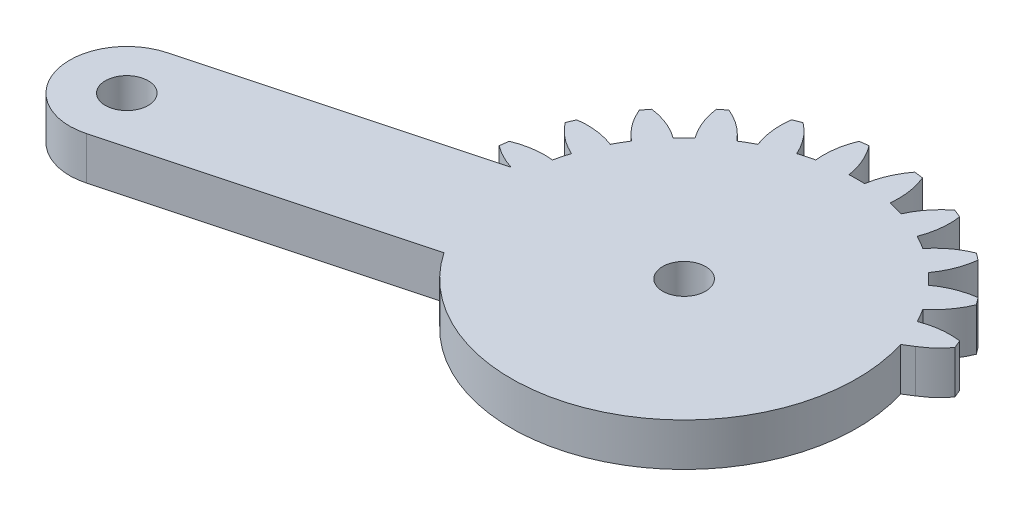
from build123d import *
from build123d.topology import SkipClean

# Parameters (mm, degrees)
SKETCH1_R           = 1.5
BOSS_EXTRUDE1_DEPTH = 3
SKETCH3_R           = 1.5
BOSS_EXTRUDE2_DEPTH = 3
CUT_EXTRUDE1_START  = -3
CUT_EXTRUDE1_DEPTH  = 3
SCALE1_SCALE        = 2


with BuildPart() as part:
    # Sketch1 → Boss-Extrude1 (new body)
    with BuildSketch(Plane(origin=(0, 0, 0), x_dir=(1, 0, 0), z_dir=(0, 1, 0))):
        with BuildLine():
            Line((20.643657446, 4), (2.081641936, 4))
            ThreePointArc((2.081641936, 4), (2.861028333, 4.588201733), (3.521749436, 5.30713988))
            ThreePointArc((3.521749436, 5.30713988), (3.405395609, 5.596745198), (3.282888305, 5.883801663))
            ThreePointArc((3.282888305, 5.883801663), (1.93527598, 5.894040025), (0.627094961, 5.57027124))
            ThreePointArc((0.627094961, 5.57027124), (0.366286148, 6.046375), (0.084372603, 6.510293938))
            ThreePointArc((0.084372603, 6.510293938), (1.018855105, 7.48132754), (1.683794586, 8.65351323))
            ThreePointArc((1.683794586, 8.65351323), (1.496450048, 8.903135899), (1.303821399, 9.148703928))
            ThreePointArc((1.303821399, 9.148703928), (-0.000522033, 8.809805691), (-1.180330337, 8.158486898))
            ThreePointArc((-1.180330337, 8.158486898), (-1.555477026, 8.550865528), (-1.947855656, 8.926012217))
            ThreePointArc((-1.947855656, 8.926012217), (-1.296536862, 10.105820521), (-0.957638625, 11.410163953))
            ThreePointArc((-0.957638625, 11.410163953), (-1.203206655, 11.602792602), (-1.452829324, 11.79013714))
            ThreePointArc((-1.452829324, 11.79013714), (-2.625015014, 11.125197659), (-3.596048616, 10.190715157))
            ThreePointArc((-3.596048616, 10.190715157), (-4.059967554, 10.472628702), (-4.536071314, 10.733437515))
            ThreePointArc((-4.536071314, 10.733437515), (-4.212302529, 12.041618533), (-4.222540891, 13.389230859))
            ThreePointArc((-4.222540891, 13.389230859), (-4.509597355, 13.511738163), (-4.799202674, 13.62809199))
            ThreePointArc((-4.799202674, 13.62809199), (-5.759348103, 12.682425791), (-6.455432668, 11.528463019))
            ThreePointArc((-6.455432668, 11.528463019), (-6.976508546, 11.680699536), (-7.503891752, 11.809396783))
            ThreePointArc((-7.503891752, 11.809396783), (-7.529737283, 13.156800143), (-7.888414517, 14.455843809))
            ThreePointArc((-7.888414517, 14.455843809), (-8.197396993, 14.499881098), (-8.507248835, 14.537314892))
            ThreePointArc((-8.507248835, 14.537314892), (-9.18992168, 13.375367565), (-9.563620196, 12.080565177))
            ThreePointArc((-9.563620196, 12.080565177), (-10.106342554, 12.09275), (-10.649064912, 12.080565177))
            ThreePointArc((-10.649064912, 12.080565177), (-11.022763428, 13.375367565), (-11.705436272, 14.537314892))
            ThreePointArc((-11.705436272, 14.537314892), (-12.015288115, 14.499881098), (-12.324270591, 14.455843809))
            ThreePointArc((-12.324270591, 14.455843809), (-12.682947825, 13.156800143), (-12.708793355, 11.809396783))
            ThreePointArc((-12.708793355, 11.809396783), (-13.236176561, 11.680699536), (-13.757252439, 11.528463019))
            ThreePointArc((-13.757252439, 11.528463019), (-14.453337005, 12.682425791), (-15.413482434, 13.62809199))
            ThreePointArc((-15.413482434, 13.62809199), (-15.703087752, 13.511738163), (-15.990144217, 13.389230859))
            ThreePointArc((-15.990144217, 13.389230859), (-16.000382579, 12.041618533), (-15.676613793, 10.733437515))
            ThreePointArc((-15.676613793, 10.733437515), (-16.152717554, 10.472628702), (-16.616636492, 10.190715157))
            ThreePointArc((-16.616636492, 10.190715157), (-17.587670094, 11.125197659), (-18.759855783, 11.79013714))
            ThreePointArc((-18.759855783, 11.79013714), (-19.009478453, 11.602792602), (-19.255046482, 11.410163953))
            ThreePointArc((-19.255046482, 11.410163953), (-18.916148245, 10.105820521), (-18.264829452, 8.926012217))
            ThreePointArc((-18.264829452, 8.926012217), (-18.657208082, 8.550865528), (-19.032354771, 8.158486898))
            ThreePointArc((-19.032354771, 8.158486898), (-20.212163074, 8.809805691), (-21.516506507, 9.148703928))
            ThreePointArc((-21.516506507, 9.148703928), (-21.709135156, 8.903135899), (-21.896479694, 8.65351323))
            ThreePointArc((-21.896479694, 8.65351323), (-21.231540213, 7.48132754), (-20.297057711, 6.510293938))
            ThreePointArc((-20.297057711, 6.510293938), (-20.578971255, 6.046375), (-20.839780068, 5.57027124))
            ThreePointArc((-20.839780068, 5.57027124), (-22.147961087, 5.894040025), (-23.495573413, 5.883801663))
            ThreePointArc((-23.495573413, 5.883801663), (-23.618080717, 5.596745198), (-23.734434544, 5.30713988))
            ThreePointArc((-23.734434544, 5.30713988), (-22.788768345, 4.346994451), (-21.634805572, 3.650909885))
            ThreePointArc((-21.634805572, 3.650909885), (-21.78704209, 3.129834008), (-21.915739337, 2.602450802))
            ThreePointArc((-21.915739337, 2.602450802), (-23.263142697, 2.576605271), (-24.562186363, 2.217928037))
            ThreePointArc((-24.562186363, 2.217928037), (-24.606223651, 1.908945561), (-24.643657446, 1.599093719))
            ThreePointArc((-24.643657446, 1.599093719), (-23.481710119, 0.916420874), (-22.186907731, 0.542722358))
            ThreePointArc((-22.186907731, 0.542722358), (-22.199092554, 0), (-22.186907731, -0.542722358))
            ThreePointArc((-22.186907731, -0.542722358), (-23.481710119, -0.916420874), (-24.643657446, -1.599093719))
            ThreePointArc((-24.643657446, -1.599093719), (-24.606223651, -1.908945561), (-24.562186363, -2.217928037))
            ThreePointArc((-24.562186363, -2.217928037), (-23.263142697, -2.576605271), (-21.915739337, -2.602450802))
            ThreePointArc((-21.915739337, -2.602450802), (-21.78704209, -3.129834008), (-21.634805572, -3.650909885))
            ThreePointArc((-21.634805572, -3.650909885), (-22.788768345, -4.346994451), (-23.734434544, -5.30713988))
            ThreePointArc((-23.734434544, -5.30713988), (-23.618080717, -5.596745198), (-23.495573413, -5.883801663))
            ThreePointArc((-23.495573413, -5.883801663), (-22.147961087, -5.894040025), (-20.839780068, -5.57027124))
            ThreePointArc((-20.839780068, -5.57027124), (-20.578971255, -6.046375), (-20.297057711, -6.510293938))
            ThreePointArc((-20.297057711, -6.510293938), (-21.231540213, -7.48132754), (-21.896479694, -8.65351323))
            ThreePointArc((-21.896479694, -8.65351323), (-21.709135156, -8.903135899), (-21.516506507, -9.148703928))
            ThreePointArc((-21.516506507, -9.148703928), (-20.212163074, -8.809805691), (-19.032354771, -8.158486898))
            ThreePointArc((-19.032354771, -8.158486898), (-18.657208082, -8.550865528), (-18.264829452, -8.926012217))
            ThreePointArc((-18.264829452, -8.926012217), (-18.916148245, -10.105820521), (-19.255046482, -11.410163953))
            ThreePointArc((-19.255046482, -11.410163953), (-19.009478453, -11.602792602), (-18.759855783, -11.79013714))
            ThreePointArc((-18.759855783, -11.79013714), (-17.587670094, -11.125197659), (-16.616636492, -10.190715157))
            ThreePointArc((-16.616636492, -10.190715157), (-16.152717554, -10.472628702), (-15.676613793, -10.733437515))
            ThreePointArc((-15.676613793, -10.733437515), (-16.000382579, -12.041618533), (-15.990144217, -13.389230859))
            ThreePointArc((-15.990144217, -13.389230859), (-15.703087752, -13.511738163), (-15.413482434, -13.62809199))
            ThreePointArc((-15.413482434, -13.62809199), (-14.453337005, -12.682425791), (-13.757252439, -11.528463019))
            ThreePointArc((-13.757252439, -11.528463019), (-13.236176561, -11.680699536), (-12.708793355, -11.809396783))
            ThreePointArc((-12.708793355, -11.809396783), (-12.682947825, -13.156800143), (-12.324270591, -14.455843809))
            ThreePointArc((-12.324270591, -14.455843809), (-12.015288115, -14.499881098), (-11.705436272, -14.537314892))
            ThreePointArc((-11.705436272, -14.537314892), (-11.022763428, -13.375367565), (-10.649064912, -12.080565177))
            ThreePointArc((-10.649064912, -12.080565177), (-10.106342554, -12.09275), (-9.563620196, -12.080565177))
            ThreePointArc((-9.563620196, -12.080565177), (-9.18992168, -13.375367565), (-8.507248835, -14.537314892))
            ThreePointArc((-8.507248835, -14.537314892), (-8.197396993, -14.499881098), (-7.888414517, -14.455843809))
            ThreePointArc((-7.888414517, -14.455843809), (-7.529737283, -13.156800143), (-7.503891752, -11.809396783))
            ThreePointArc((-7.503891752, -11.809396783), (-6.976508546, -11.680699536), (-6.455432668, -11.528463019))
            ThreePointArc((-6.455432668, -11.528463019), (-5.759348103, -12.682425791), (-4.799202674, -13.62809199))
            ThreePointArc((-4.799202674, -13.62809199), (-4.509597355, -13.511738163), (-4.222540891, -13.389230859))
            ThreePointArc((-4.222540891, -13.389230859), (-4.212302529, -12.041618533), (-4.536071314, -10.733437515))
            ThreePointArc((-4.536071314, -10.733437515), (-4.059967554, -10.472628702), (-3.596048616, -10.190715157))
            ThreePointArc((-3.596048616, -10.190715157), (-2.625015014, -11.125197659), (-1.452829324, -11.79013714))
            ThreePointArc((-1.452829324, -11.79013714), (-1.203206655, -11.602792602), (-0.957638625, -11.410163953))
            ThreePointArc((-0.957638625, -11.410163953), (-1.296536862, -10.105820521), (-1.947855656, -8.926012217))
            ThreePointArc((-1.947855656, -8.926012217), (-1.555477026, -8.550865528), (-1.180330337, -8.158486898))
            ThreePointArc((-1.180330337, -8.158486898), (-0.000522033, -8.809805691), (1.303821399, -9.148703928))
            ThreePointArc((1.303821399, -9.148703928), (1.496450048, -8.903135899), (1.683794586, -8.65351323))
            ThreePointArc((1.683794586, -8.65351323), (1.018855105, -7.48132754), (0.084372603, -6.510293938))
            ThreePointArc((0.084372603, -6.510293938), (0.366286148, -6.046375), (0.627094961, -5.57027124))
            ThreePointArc((0.627094961, -5.57027124), (1.93527598, -5.894040025), (3.282888305, -5.883801663))
            ThreePointArc((3.282888305, -5.883801663), (3.405395609, -5.596745198), (3.521749436, -5.30713988))
            ThreePointArc((3.521749436, -5.30713988), (2.861028333, -4.588201733), (2.081641936, -4))
            Line((2.081641936, -4), (20.643657446, -4))
            ThreePointArc((20.643657446, -4), (24.643657446, 0), (20.643657446, 4))
        make_face()
        with Locations(Location((-10.106342554, 0, 0), (0, 0, 270))):
            Circle(SKETCH1_R, mode=Mode.SUBTRACT)
        with Locations(Location((20.643657446, 0, 0), (0, 0, 270))):
            Circle(SKETCH1_R, mode=Mode.SUBTRACT)
    extrude(amount=BOSS_EXTRUDE1_DEPTH)

    # Sketch3 → Boss-Extrude2 (add)
    with BuildSketch(Plane(origin=(0, 3, 0), x_dir=(1, 0, 0), z_dir=(0, 1, 0))):
        with BuildLine():
            ThreePointArc((-9.071066373, -3.863703305), (-13.970045859, -1.03527618), (-11.141618734, 3.863703305))
            Line((-11.141618734, 3.863703305), (-41.891618734, -4.375734362))
            ThreePointArc((-41.891618734, -4.375734362), (-44.720045859, -9.274713848), (-39.821066373, -12.103140972))
            Line((-39.821066373, -12.103140972), (-9.071066373, -3.863703305))
        make_face()
        with Locations(Location((-40.856342554, -8.239437667, 0), (0, 0, 270))):
            Circle(SKETCH3_R, mode=Mode.SUBTRACT)
    extrude(amount=-BOSS_EXTRUDE2_DEPTH)

    # Sketch4 → Cut-Extrude1 (cut)
    with SkipClean():  # the faces are left unmerged after this step: merging them gives an invalid solid
        with BuildSketch(Plane(origin=(0, 3, 0), x_dir=(1, 0, 0), z_dir=(0, 1, 0)).offset(CUT_EXTRUDE1_START)):
            with BuildLine():
                ThreePointArc((-21.516506507, -9.148703928), (-20.212163074, -8.809805691), (-19.032354771, -8.158486898))
                ThreePointArc((-19.032354771, -8.158486898), (-19.58704562, -7.506721784), (-20.094248238, -6.817355984))
                Line((-20.094248238, -6.817355984), (-20.843755363, -7.018185813))
                ThreePointArc((-20.843755363, -7.018185813), (-21.444347002, -7.788065101), (-21.896479694, -8.65351323))
                ThreePointArc((-21.896479694, -8.65351323), (-21.709135156, -8.903135899), (-21.516506507, -9.148703928))
            make_face()
            with BuildLine():
                ThreePointArc((-18.759855783, -11.79013714), (-17.587670094, -11.125197659), (-16.616636492, -10.190715157))
                ThreePointArc((-16.616636492, -10.190715157), (-17.467942324, -9.593823606), (-18.264829452, -8.926012217))
                ThreePointArc((-18.264829452, -8.926012217), (-18.916148245, -10.105820521), (-19.255046482, -11.410163953))
                ThreePointArc((-19.255046482, -11.410163953), (-19.009478453, -11.602792602), (-18.759855783, -11.79013714))
            make_face()
            with BuildLine():
                ThreePointArc((-15.413482434, -13.62809199), (-14.453337005, -12.682425791), (-13.757252439, -11.528463019))
                ThreePointArc((-13.757252439, -11.528463019), (-14.734037631, -11.172244217), (-15.676613793, -10.733437515))
                ThreePointArc((-15.676613793, -10.733437515), (-16.000382579, -12.041618533), (-15.990144217, -13.389230859))
                ThreePointArc((-15.990144217, -13.389230859), (-15.703087752, -13.511738163), (-15.413482434, -13.62809199))
            make_face()
            with BuildLine():
                ThreePointArc((-11.705436272, -14.537314892), (-11.022763428, -13.375367565), (-10.649064912, -12.080565177))
                ThreePointArc((-10.649064912, -12.080565177), (-11.684763165, -11.989294847), (-12.708793355, -11.809396783))
                ThreePointArc((-12.708793355, -11.809396783), (-12.682947825, -13.156800143), (-12.324270591, -14.455843809))
                ThreePointArc((-12.324270591, -14.455843809), (-12.015288115, -14.499881098), (-11.705436272, -14.537314892))
            make_face()
            with BuildLine():
                ThreePointArc((-7.888414517, -14.455843809), (-7.529737283, -13.156800143), (-7.503891752, -11.809396783))
                ThreePointArc((-7.503891752, -11.809396783), (-8.527921943, -11.989294847), (-9.563620196, -12.080565177))
                ThreePointArc((-9.563620196, -12.080565177), (-9.18992168, -13.375367565), (-8.507248835, -14.537314892))
                ThreePointArc((-8.507248835, -14.537314892), (-8.197396993, -14.499881098), (-7.888414517, -14.455843809))
            make_face()
            with BuildLine():
                ThreePointArc((-4.222540891, -13.389230859), (-4.212302529, -12.041618533), (-4.536071314, -10.733437515))
                ThreePointArc((-4.536071314, -10.733437515), (-5.478647477, -11.172244217), (-6.455432668, -11.528463019))
                ThreePointArc((-6.455432668, -11.528463019), (-5.759348103, -12.682425791), (-4.799202674, -13.62809199))
                ThreePointArc((-4.799202674, -13.62809199), (-4.509597355, -13.511738163), (-4.222540891, -13.389230859))
            make_face()
            with BuildLine():
                ThreePointArc((-0.957638625, -11.410163953), (-1.296536862, -10.105820521), (-1.947855656, -8.926012217))
                ThreePointArc((-1.947855656, -8.926012217), (-2.744742783, -9.593823606), (-3.596048616, -10.190715157))
                ThreePointArc((-3.596048616, -10.190715157), (-2.625015014, -11.125197659), (-1.452829324, -11.79013714))
                ThreePointArc((-1.452829324, -11.79013714), (-1.203206655, -11.602792602), (-0.957638625, -11.410163953))
            make_face()
            with BuildLine():
                ThreePointArc((1.683794586, -8.65351323), (1.018855105, -7.48132754), (0.084372603, -6.510293938))
                ThreePointArc((0.084372603, -6.510293938), (-0.512518948, -7.361599771), (-1.180330337, -8.158486898))
                ThreePointArc((-1.180330337, -8.158486898), (-0.000522033, -8.809805691), (1.303821399, -9.148703928))
                ThreePointArc((1.303821399, -9.148703928), (1.496450048, -8.903135899), (1.683794586, -8.65351323))
            make_face()
            with BuildLine():
                ThreePointArc((20.643657446, -4), (24.643657446, 0), (20.643657446, 4))
                Line((20.643657446, 4), (2.081641936, 4))
                Line((2.081641936, 4), (1.43808022, 3.600125745))
                ThreePointArc((1.43808022, 3.600125745), (1.848539735, 1.820821801), (1.986407446, 0))
                ThreePointArc((1.986407446, 0), (1.641665343, -2.866864669), (0.627094961, -5.57027124))
                ThreePointArc((0.627094961, -5.57027124), (1.93527598, -5.894040025), (3.282888305, -5.883801663))
                ThreePointArc((3.282888305, -5.883801663), (3.405395609, -5.596745198), (3.521749436, -5.30713988))
                ThreePointArc((3.521749436, -5.30713988), (2.861028333, -4.588201733), (2.081641936, -4))
                Line((2.081641936, -4), (20.643657446, -4))
            make_face()
        extrude(amount=CUT_EXTRUDE1_DEPTH, mode=Mode.SUBTRACT)


with BuildPart() as part_1:
    # Scale1: scaled about (-16.0667017, 1.5, 0.986610276)
    add(part.part.scale(SCALE1_SCALE).moved(Location((16.0667017, -1.5, -0.986610276))))


solid = part_1.part
